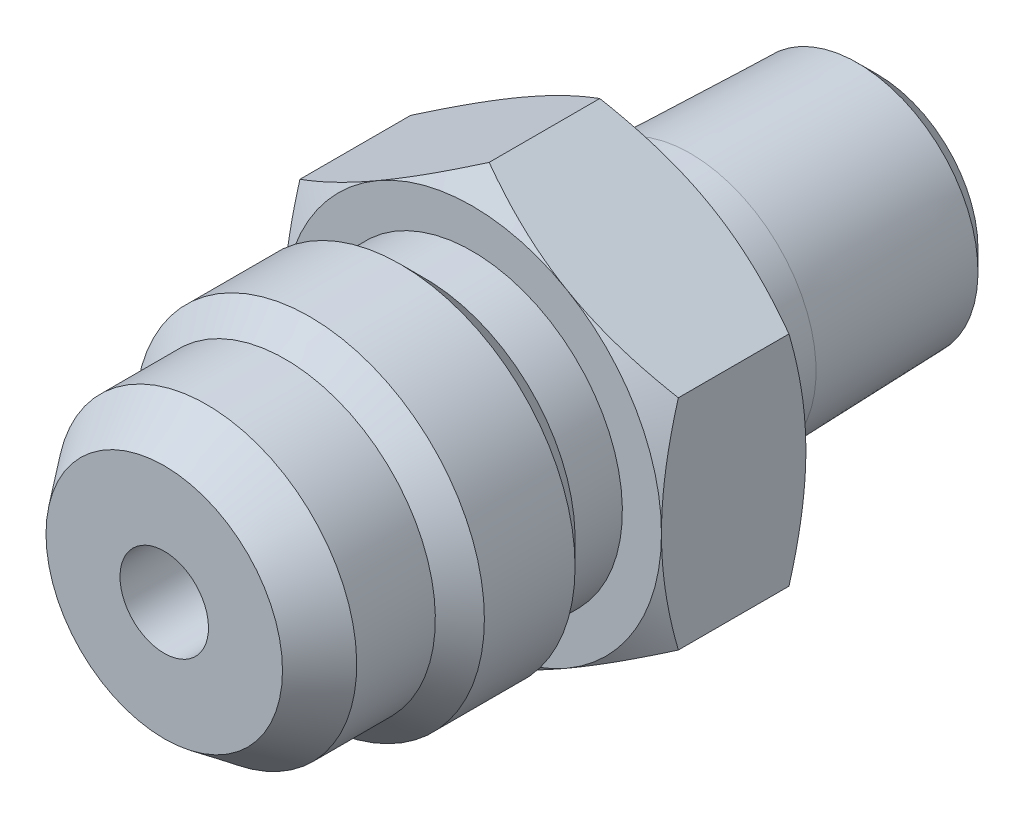
from build123d import *

# Parameters (mm, degrees)
SKETCH2_R           = 10.19175
BOSS_EXTRUDE1_DEPTH = 7.874


with BuildPart() as part:
    # Sketch1 → Revolve1 (revolve)
    with BuildSketch(Plane(origin=(0, 0, 0), x_dir=(0, 0, -1), z_dir=(1, 0, 0)), mode=Mode.PRIVATE) as revolve1_sk:
        Polygon((-19.446875, 2.413), (-19.446875, 6.448056668), (-17.138253125, 8.187728032), (-12.8508125, 8.187728032), (-11.513540532, 9.525), (-6.568084468, 9.525), (-5.2308125, 8.187728032), (-2.651125, 8.187728032), (-2.651125, 10.31875), (5.222875, 10.31875), (5.222875, 6.858), (9.241155, 6.858), (18.354531448, 6.574254175), (19.446875, 5.481910623), (19.446875, 2.413), align=None)
    revolve(revolve1_sk.sketch.rotate(Axis((0, 0, 19.446875), (0, 0, -1)), 180), axis=Axis((0, 0, 19.446875), (0, 0, -1)))

    # Sketch2 → Boss-Extrude1 (add)
    with BuildSketch(Plane.XY.offset(2.651125)):
        Polygon((0, 11.91506618), (-10.31875, 5.95753309), (-10.31875, -5.95753309), (0, -11.91506618), (10.31875, -5.95753309), (10.31875, 5.95753309), align=None)
        Circle(SKETCH2_R, mode=Mode.SUBTRACT)
    extrude(amount=-BOSS_EXTRUDE1_DEPTH)

    # Sketch3 → Cut-Revolve1 (revolve, cut)
    with BuildSketch(Plane(origin=(0, 0, 0), x_dir=(0, 0, -1), z_dir=(1, 0, 0))):
        Polygon((-2.651125, 10.31875), (-2.651125, 11.91506618), (-1.729491424, 11.91506618), align=None)
        Polygon((4.301241424, 11.91506618), (5.222875, 10.31875), (5.222875, 11.91506618), align=None)
    revolve(axis=Axis((0, 0, 19.446875), (0, 0, -1)), mode=Mode.SUBTRACT)


solid = part.part
